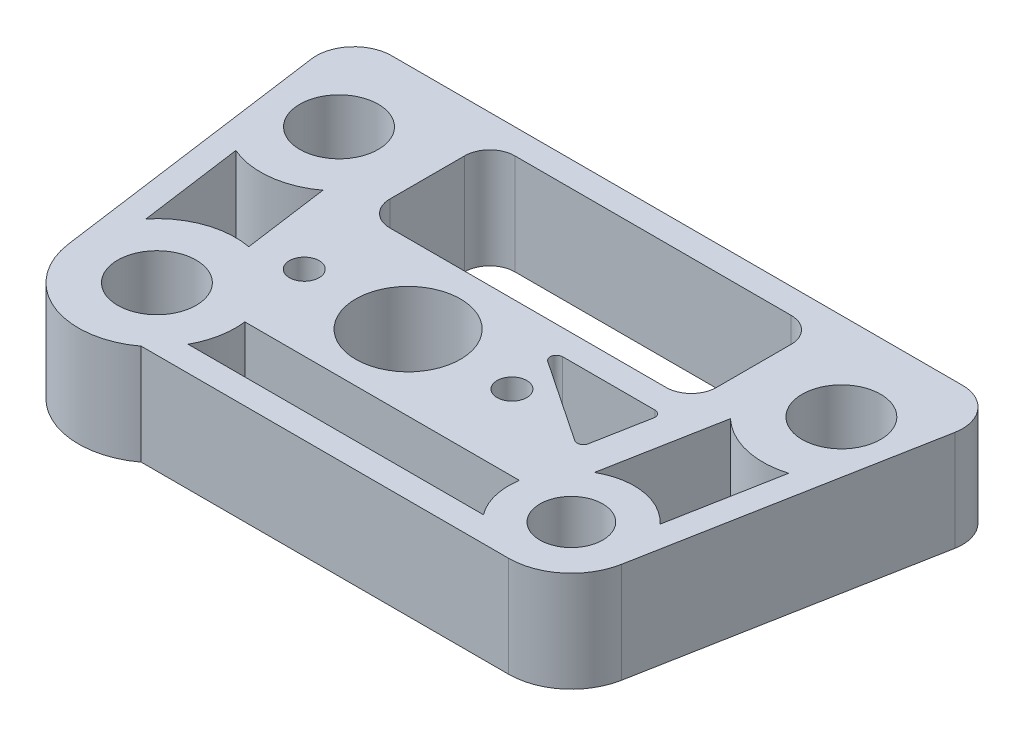
from build123d import *

# Parameters (mm, degrees)
SKETCH4_R           = 3.96875
SKETCH4_R_2         = 5.2959
SKETCH4_R_3         = 1.5
SKETCH4_R_4         = 3.175
BOSS_EXTRUDE2_DEPTH = 10.16
FILLET1_R           = 3.81


with BuildPart() as part:
    # Sketch4 → Boss-Extrude2 (new body)
    with BuildSketch(Plane(origin=(0, 0, 0), x_dir=(1, 0, 0), z_dir=(0, 1, 0))):
        with BuildLine():
            Line((54.2925, 31.75), (-12.3825, 31.75))
            Line((-12.3825, 31.75), (-7.863361559, -1.082336008))
            ThreePointArc((-7.863361559, -1.082336008), (-3.056289676, -7.325503373), (4.7625, -6.35))
            Line((4.7625, -6.35), (41.91, -6.35))
            ThreePointArc((41.91, -6.35), (45.967580476, -4.884520517), (48.152310263, -1.164501002))
            Line((48.152310263, -1.164501002), (54.2925, 31.75))
        make_face()
        with Locations(Location((0, 0, 0), (0, 0, 270))):
            Circle(SKETCH4_R, mode=Mode.SUBTRACT)
        with Locations(Location((46.355, 22.86, 0), (0, 0, 270))):
            Circle(SKETCH4_R, mode=Mode.SUBTRACT)
        with Locations(Location((-4.445, 22.86, 0), (0, 0, 270))):
            Circle(SKETCH4_R, mode=Mode.SUBTRACT)
        with Locations(Location((16.764, 8.636, 0), (0, 0, 270))):
            Circle(SKETCH4_R_2, mode=Mode.SUBTRACT)
        with Locations(Location((27.264, 8.636, 0), (0, 0, 270))):
            Circle(SKETCH4_R_3, mode=Mode.SUBTRACT)
        with Locations(Location((6.264, 8.636, 0), (0, 0, 270))):
            Circle(SKETCH4_R_3, mode=Mode.SUBTRACT)
        with Locations(Location((41.91, 0, 0), (0, 0, 270))):
            Circle(SKETCH4_R_4, mode=Mode.SUBTRACT)
        with BuildLine():
            Line((34.925, 29.21), (6.985, 29.21))
            ThreePointArc((6.985, 29.21), (5.188948776, 28.466051224), (4.445, 26.67))
            Line((4.445, 26.67), (4.445, 19.1135))
            ThreePointArc((4.445, 19.1135), (5.188948776, 17.317448776), (6.985, 16.5735))
            Line((6.985, 16.5735), (34.925, 16.5735))
            ThreePointArc((34.925, 16.5735), (36.721051224, 17.317448776), (37.465, 19.1135))
            Line((37.465, 19.1135), (37.465, 26.67))
            ThreePointArc((37.465, 26.67), (36.721051224, 28.466051224), (34.925, 29.21))
        make_face(mode=Mode.SUBTRACT)
        with BuildLine():
            Line((46.58698696, 4.295147609), (48.631735848, 15.256028661))
            ThreePointArc((48.631735848, 15.256028661), (44.519378774, 15.137668683), (40.900146495, 17.093850549))
            Line((40.900146495, 17.093850549), (38.737442476, 5.500670755))
            ThreePointArc((38.737442476, 5.500670755), (42.873923491, 6.276412312), (46.58698696, 4.295147609))
        make_face(mode=Mode.SUBTRACT)
        with BuildLine():
            Line((36.83, -3.81), (6.963318623, -3.81))
            ThreePointArc((6.963318623, -3.81), (7.800370345, -1.469057088), (7.872207457, 1.016))
            Line((7.872207457, 1.016), (35.641806959, 1.016))
            ThreePointArc((35.641806959, 1.016), (35.744131016, -1.518077625), (36.83, -3.81))
        make_face(mode=Mode.SUBTRACT)
        with BuildLine():
            Line((-6.14066773, 5.029523445), (-7.591897143, 15.572960504))
            ThreePointArc((-7.591897143, 15.572960504), (-3.525796009, 14.975903966), (0.293891225, 16.492361803))
            Line((0.293891225, 16.492361803), (1.490851578, 7.796234208))
            ThreePointArc((1.490851578, 7.796234208), (-2.705340953, 7.462240721), (-6.14066773, 5.029523445))
        make_face(mode=Mode.SUBTRACT)
        with BuildLine():
            Line((35.921478098, 7.718896983), (36.959282513, 13.2820499))
            ThreePointArc((36.959282513, 13.2820499), (36.823503538, 13.804258048), (36.335051487, 14.0335))
            Line((36.335051487, 14.0335), (27.003423807, 14.0335))
            ThreePointArc((27.003423807, 14.0335), (26.395931126, 13.583371961), (26.649696678, 12.871146117))
            Line((26.649696678, 12.871146117), (34.943519943, 7.307993201))
            ThreePointArc((34.943519943, 7.307993201), (35.543221805, 7.249922938), (35.921478098, 7.718896983))
        make_face(mode=Mode.SUBTRACT)
    extrude(amount=BOSS_EXTRUDE2_DEPTH)

    # Fillet1
    fillet1_edges = [part.edges().sort_by_distance(p)[0] for p in [
        (-12.3825, 5.08, -31.75),
        (54.2925, 5.08, -31.75),
    ]]
    fillet(fillet1_edges, radius=FILLET1_R)


solid = part.part
